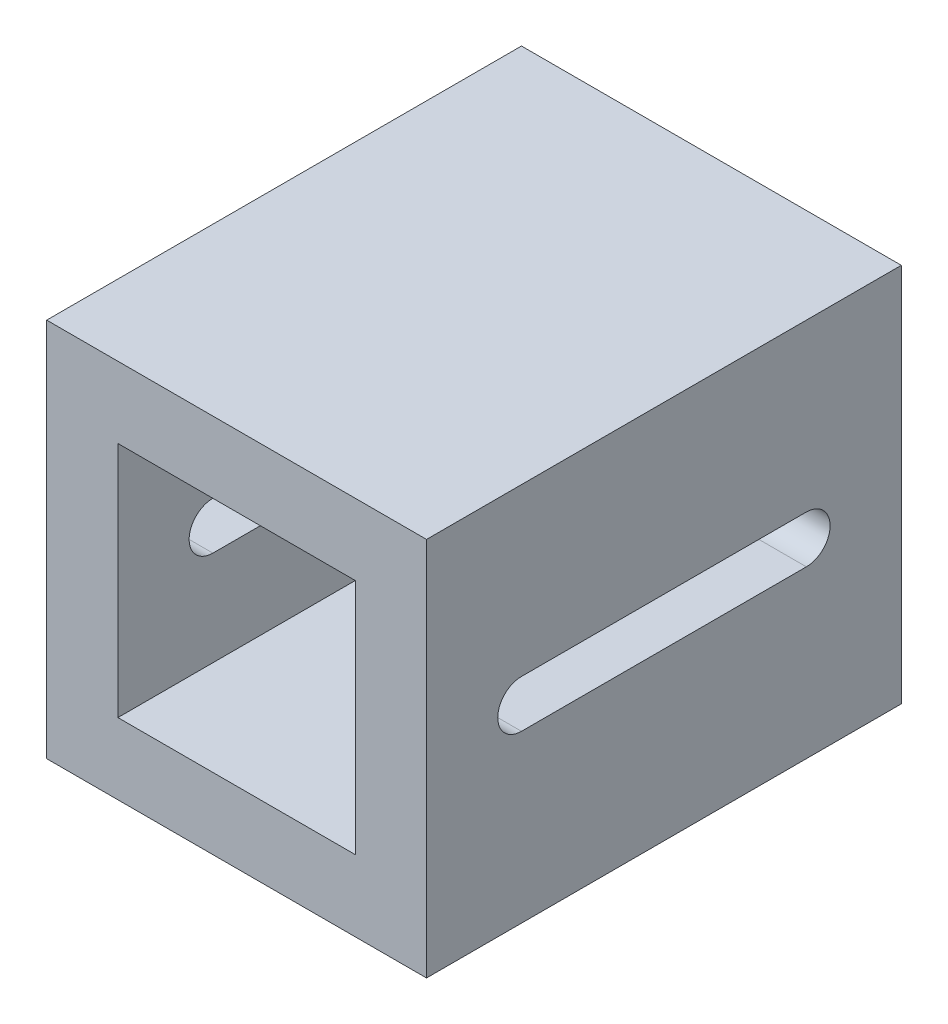
from build123d import *

# Parameters (mm, degrees)
SKETCH_1_W          = 16
SKETCH_1_H          = 16
SKETCH_1_W_2        = 10
SKETCH_1_H_2        = 10
EXTRUDE_1_DEPTH     = 20
CUT_EXTRUDE_1_DEPTH = 16


with BuildPart() as part:
    # 草图1 → 凸台-拉伸1 (new body)
    with BuildSketch(Plane.XY):
        with Locations((8, 8)):
            Rectangle(SKETCH_1_W, SKETCH_1_H)
        with Locations((8, 8)):
            Rectangle(SKETCH_1_W_2, SKETCH_1_H_2, mode=Mode.SUBTRACT)
    extrude(amount=EXTRUDE_1_DEPTH)

    # 草图2 → 切除-拉伸1 (cut)
    with BuildSketch(Plane(origin=(16, 0, 0), x_dir=(0, 0, -1), z_dir=(1, 0, 0))):
        with BuildLine():
            Line((-4, 9), (-16, 9))
            ThreePointArc((-16, 9), (-15.292893219, 8.707106781), (-15, 8))
            ThreePointArc((-15, 8), (-15.292893219, 7.292893219), (-16, 7))
            Line((-16, 7), (-4, 7))
            ThreePointArc((-4, 7), (-5, 8), (-4, 9))
        make_face()
        with BuildLine():
            ThreePointArc((-3, 8), (-3.292893219, 8.707106781), (-4, 9))
            Line((-4, 9), (-4, 7))
            ThreePointArc((-4, 7), (-3.292893219, 7.292893219), (-3, 8))
        make_face()
        with BuildLine():
            Line((-4, 7), (-4, 9))
            ThreePointArc((-4, 9), (-5, 8), (-4, 7))
        make_face()
        with BuildLine():
            ThreePointArc((-15, 8), (-15.292893219, 8.707106781), (-16, 9))
            Line((-16, 9), (-16, 7))
            ThreePointArc((-16, 7), (-15.292893219, 7.292893219), (-15, 8))
        make_face()
        with BuildLine():
            Line((-16, 7), (-16, 9))
            ThreePointArc((-16, 9), (-17, 8), (-16, 7))
        make_face()
    extrude(amount=-CUT_EXTRUDE_1_DEPTH, mode=Mode.SUBTRACT)


solid = part.part
